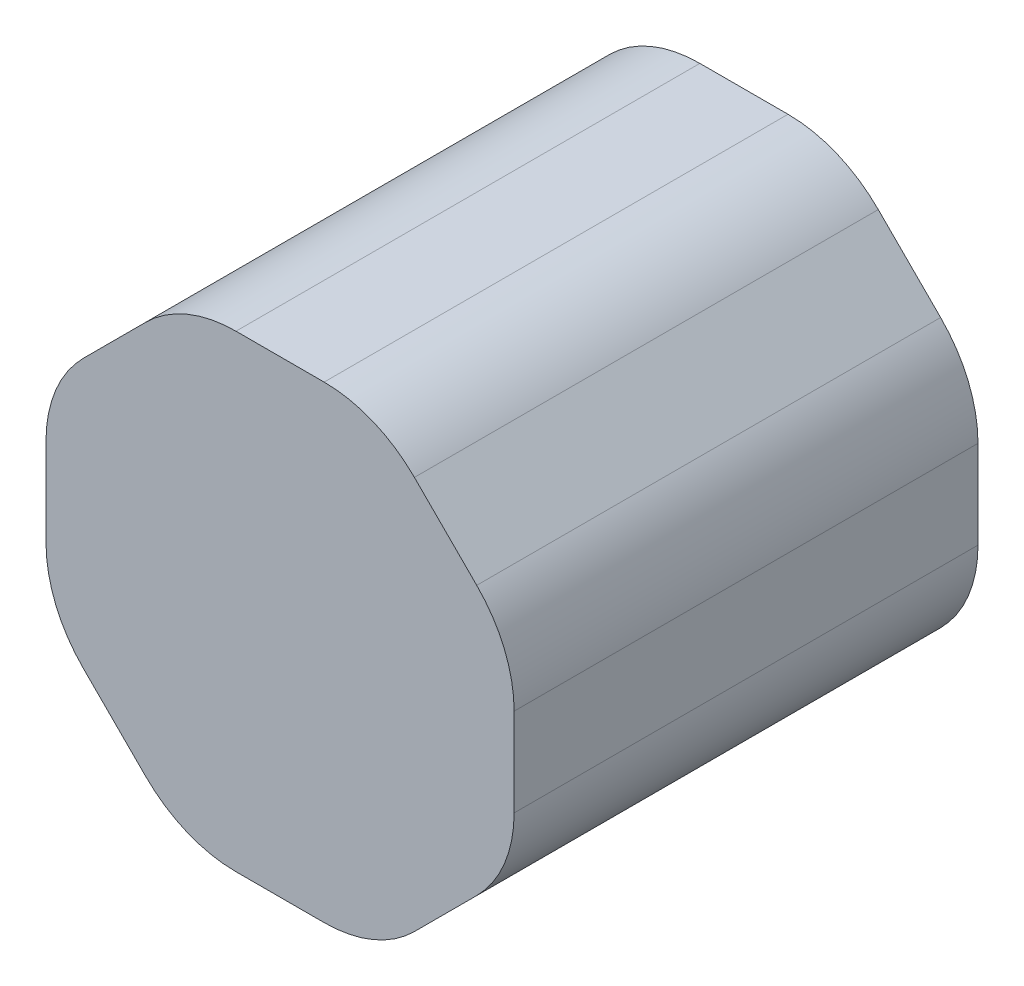
from build123d import *

# Parameters (mm, degrees)
RESSALTO_EXTRUS_O1_DEPTH = 109


with BuildPart() as part:
    # Esboço1 → Ressalto-extrusão1 (new body)
    with BuildSketch(Plane.XY):
        with BuildLine():
            Line((55, -10.355339059), (55, 10.355339059))
            ThreePointArc((55, 10.355339059), (52.716385975, 21.83584203), (46.213203436, 31.568542495))
            Line((46.213203436, 31.568542495), (31.568542495, 46.213203436))
            ThreePointArc((31.568542495, 46.213203436), (21.83584203, 52.716385975), (10.355339059, 55))
            Line((10.355339059, 55), (-10.355339059, 55))
            ThreePointArc((-10.355339059, 55), (-21.83584203, 52.716385975), (-31.568542495, 46.213203436))
            Line((-31.568542495, 46.213203436), (-46.213203436, 31.568542495))
            ThreePointArc((-46.213203436, 31.568542495), (-52.716385975, 21.83584203), (-55, 10.355339059))
            Line((-55, 10.355339059), (-55, -10.355339059))
            ThreePointArc((-55, -10.355339059), (-52.716385975, -21.83584203), (-46.213203436, -31.568542495))
            Line((-46.213203436, -31.568542495), (-31.568542495, -46.213203436))
            ThreePointArc((-31.568542495, -46.213203436), (-21.83584203, -52.716385975), (-10.355339059, -55))
            Line((-10.355339059, -55), (10.355339059, -55))
            ThreePointArc((10.355339059, -55), (21.83584203, -52.716385975), (31.568542495, -46.213203436))
            Line((31.568542495, -46.213203436), (46.213203436, -31.568542495))
            ThreePointArc((46.213203436, -31.568542495), (52.716385975, -21.83584203), (55, -10.355339059))
        make_face()
    extrude(amount=RESSALTO_EXTRUS_O1_DEPTH)


solid = part.part
